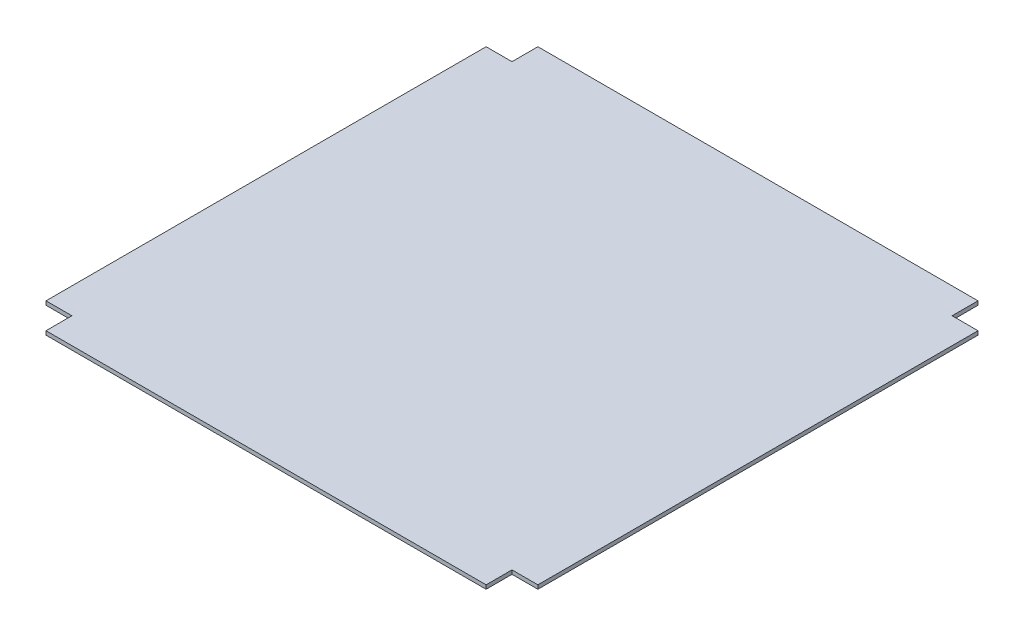
from build123d import *

# Parameters (mm, degrees)
EXTRUDE_3_DEPTH = 3
SKETCH_4_R      = 15
EXTRUDE_4_DEPTH = 1


with BuildPart() as part:
    # 草图3 → 凸台-拉伸3 (new body)
    with BuildSketch(Plane(origin=(0, 0, 0), x_dir=(1, 0, 0), z_dir=(0, 1, 0))):
        Polygon((170, 190), (170, 170), (190, 170), (190, -170), (170, -170), (170, -190), (-170, -190), (-170, -170), (-190, -170), (-190, 170), (-170, 170), (-170, 190), align=None)
    extrude(amount=EXTRUDE_3_DEPTH)

    # 草图4 → 凸台-拉伸4 (add)
    with BuildSketch(Plane.XZ):
        with Locations(Location((0, 0, 0), (0, 0, 270))):
            Circle(SKETCH_4_R)
    extrude(amount=EXTRUDE_4_DEPTH)


solid = part.part
